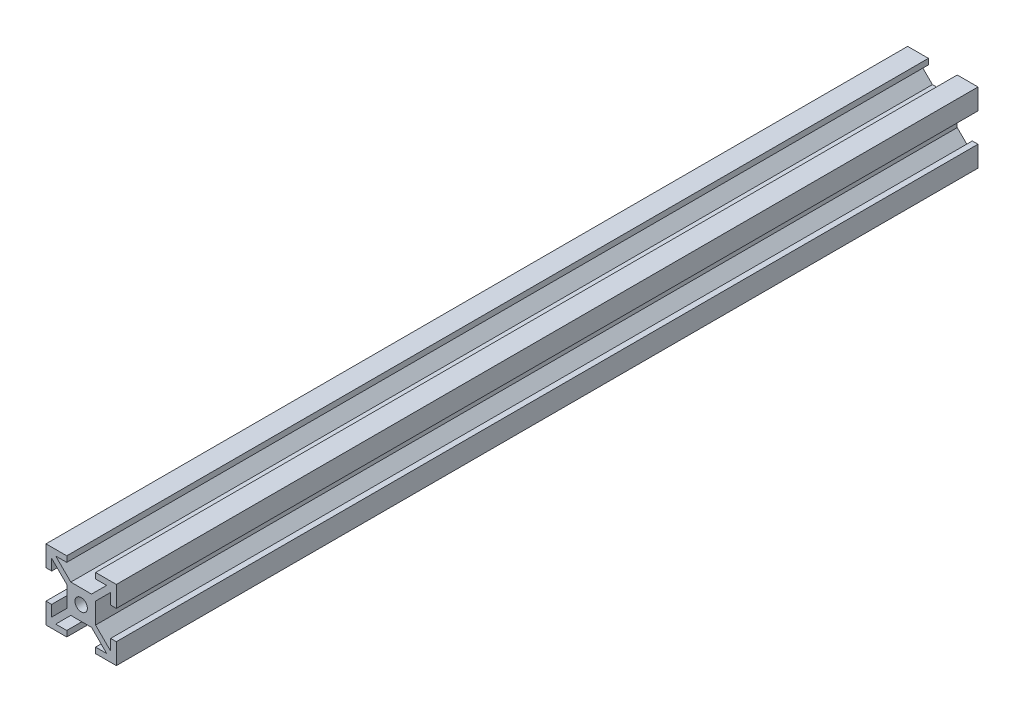
from build123d import *

# Parameters (mm, degrees)
SKETCH1_R           = 1.77
BOSS_EXTRUDE1_DEPTH = 245


with BuildPart() as part:
    # Sketch1 → Boss-Extrude1 (new body)
    with BuildSketch(Plane.XY):
        Polygon((-8.38, 4.1), (-10, 4.1), (-10, 10), (-4.1, 10), (-4.1, 8.38), (-7.234487014, 8.38), (-2.954487014, 4.1), (2.954487014, 4.1), (7.234487014, 8.38), (4.1, 8.38), (4.1, 10), (10, 10), (10, 4.1), (8.38, 4.1), (8.38, 7.234487014), (4.1, 2.954487014), (4.1, -2.954487014), (8.38, -7.234487014), (8.38, -4.1), (10, -4.1), (10, -10), (4.1, -10), (4.1, -8.38), (7.234487014, -8.38), (2.954487014, -4.1), (-2.954487014, -4.1), (-7.234487014, -8.38), (-4.1, -8.38), (-4.1, -10), (-10, -10), (-10, -4.1), (-8.38, -4.1), (-8.38, -7.234487014), (-4.1, -2.954487014), (-4.1, 2.954487014), (-8.38, 7.234487014), align=None)
        Circle(SKETCH1_R, mode=Mode.SUBTRACT)
    extrude(amount=BOSS_EXTRUDE1_DEPTH)


solid = part.part
